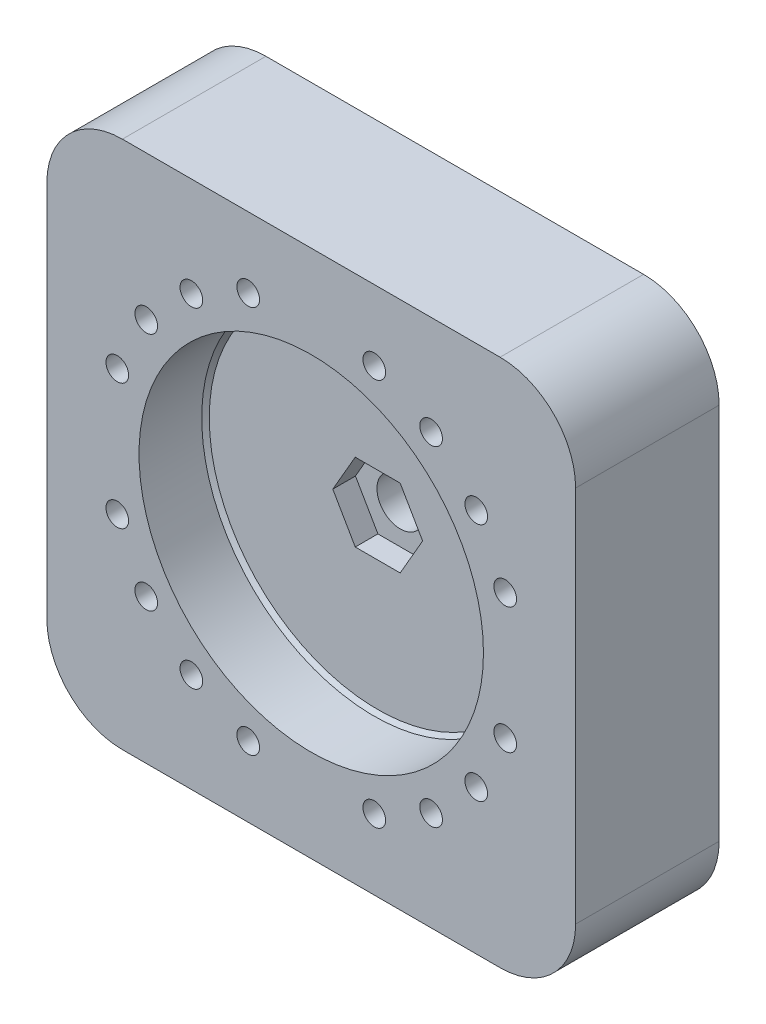
from build123d import *

# Parameters (mm, degrees)
SKETCH_1_W          = 70
SKETCH_1_H          = 70
EXTRUDE_1_DEPTH     = 19
SKETCH_2_R          = 22.8
CUT_EXTRUDE_1_DEPTH = 8.8
SKETCH_3_R          = 1.5
CUT_EXTRUDE_2_DEPTH = 19
SKETCH_5_R          = 3.25
CUT_EXTRUDE_3_DEPTH = 2
SKETCH_6_R          = 3.1
CUT_EXTRUDE_4_DEPTH = 7.5
CHAMFER_2_SIZE      = 0.5
CUT_EXTRUDE_5_DEPTH = 3
FILLET_1_R          = 10


with BuildPart() as part:
    # Эскиз1 → Бобышка-Вытянуть1 (new body)
    with BuildSketch(Plane.XY):
        Rectangle(SKETCH_1_W, SKETCH_1_H)
    extrude(amount=EXTRUDE_1_DEPTH)

    # Эскиз2 → Вырез-Вытянуть1 (cut)
    with BuildSketch(Plane.XY.offset(19)):
        Circle(SKETCH_2_R)
    extrude(amount=-CUT_EXTRUDE_1_DEPTH, mode=Mode.SUBTRACT)

    # Эскиз3 → Вырез-Вытянуть2 (cut)
    with BuildSketch(Plane.XY.offset(19)):
        with Locations((-8.343458848, 25.67852594)):
            Circle(SKETCH_3_R)
        with Locations((8.343458848, 25.67852594)):
            Circle(SKETCH_3_R)
        with Locations((15.870201812, 21.843458848)):
            Circle(SKETCH_3_R)
        with Locations((21.843458848, 15.870201812)):
            Circle(SKETCH_3_R)
        with Locations((25.67852594, 8.343458848)):
            Circle(SKETCH_3_R)
        with Locations((25.67852594, -8.343458848)):
            Circle(SKETCH_3_R)
        with Locations((21.843458848, -15.870201812)):
            Circle(SKETCH_3_R)
        with Locations((15.870201812, -21.843458848)):
            Circle(SKETCH_3_R)
        with Locations((8.343458848, -25.67852594)):
            Circle(SKETCH_3_R)
        with Locations((-8.343458848, -25.67852594)):
            Circle(SKETCH_3_R)
        with Locations((-15.870201812, -21.843458848)):
            Circle(SKETCH_3_R)
        with Locations((-21.843458848, -15.870201812)):
            Circle(SKETCH_3_R)
        with Locations((-25.67852594, -8.343458848)):
            Circle(SKETCH_3_R)
        with Locations((-25.67852594, 8.343458848)):
            Circle(SKETCH_3_R)
        with Locations((-21.843458848, 15.870201812)):
            Circle(SKETCH_3_R)
        with Locations((-15.870201812, 21.843458848)):
            Circle(SKETCH_3_R)
    extrude(amount=-CUT_EXTRUDE_2_DEPTH, mode=Mode.SUBTRACT)

    # Эскиз5 → Вырез-Вытянуть3 (cut)
    with BuildSketch(Plane(origin=(0, 0, 0), x_dir=(-1, 0, 0), z_dir=(0, 0, -1))):
        with Locations((-8.343458848, 25.67852594)):
            Circle(SKETCH_5_R)
        with Locations((8.343458848, 25.67852594)):
            Circle(SKETCH_5_R)
        with Locations((15.870201812, 21.843458848)):
            Circle(SKETCH_5_R)
        with Locations((21.843458848, 15.870201812)):
            Circle(SKETCH_5_R)
        with Locations((25.67852594, 8.343458848)):
            Circle(SKETCH_5_R)
        with Locations((25.67852594, -8.343458848)):
            Circle(SKETCH_5_R)
        with Locations((21.843458848, -15.870201812)):
            Circle(SKETCH_5_R)
        with Locations((15.870201812, -21.843458848)):
            Circle(SKETCH_5_R)
        with Locations((8.343458848, -25.67852594)):
            Circle(SKETCH_5_R)
        with Locations((-8.343458848, -25.67852594)):
            Circle(SKETCH_5_R)
        with Locations((-15.870201812, -21.843458848)):
            Circle(SKETCH_5_R)
        with Locations((-21.843458848, -15.870201812)):
            Circle(SKETCH_5_R)
        with Locations((-25.67852594, -8.343458848)):
            Circle(SKETCH_5_R)
        with Locations((-25.67852594, 8.343458848)):
            Circle(SKETCH_5_R)
        with Locations((-21.843458848, 15.870201812)):
            Circle(SKETCH_5_R)
        with Locations((-15.870201812, 21.843458848)):
            Circle(SKETCH_5_R)
    extrude(amount=-CUT_EXTRUDE_3_DEPTH, mode=Mode.SUBTRACT)

    # Эскиз6 → Вырез-Вытянуть4 (cut)
    with BuildSketch(Plane(origin=(0, 0, 0), x_dir=(-1, 0, 0), z_dir=(0, 0, -1))):
        with Locations((0, -19)):
            Circle(SKETCH_6_R)
        with Locations((0, 19)):
            Circle(SKETCH_6_R)
        with Locations((-19, 0)):
            Circle(SKETCH_6_R)
        with Locations((19, 0)):
            Circle(SKETCH_6_R)
        Circle(SKETCH_6_R)
    extrude(amount=-CUT_EXTRUDE_4_DEPTH, mode=Mode.SUBTRACT)

    # Фаска2
    chamfer_2_edges = [part.edges().sort_by_distance(p)[0] for p in [
        (-22.8, 0, 10.2),
    ]]
    chamfer(chamfer_2_edges, length=CHAMFER_2_SIZE)

    # Эскиз7 → Вырез-Вытянуть5 (cut)
    with BuildSketch(Plane.XY.offset(10.2)):
        Polygon((-2.973353886, 5.15), (-5.946707773, 0), (-2.973353886, -5.15), (2.973353886, -5.15), (5.946707773, 0), (2.973353886, 5.15), align=None)
    extrude(amount=-CUT_EXTRUDE_5_DEPTH, mode=Mode.SUBTRACT)

    # Скругление1
    fillet_1_edges = [part.edges().sort_by_distance(p)[0] for p in [
        (35, -35, 9.5),
        (-35, -35, 9.5),
        (-35, 35, 9.5),
        (35, 35, 9.5),
    ]]
    fillet(fillet_1_edges, radius=FILLET_1_R)


solid = part.part
